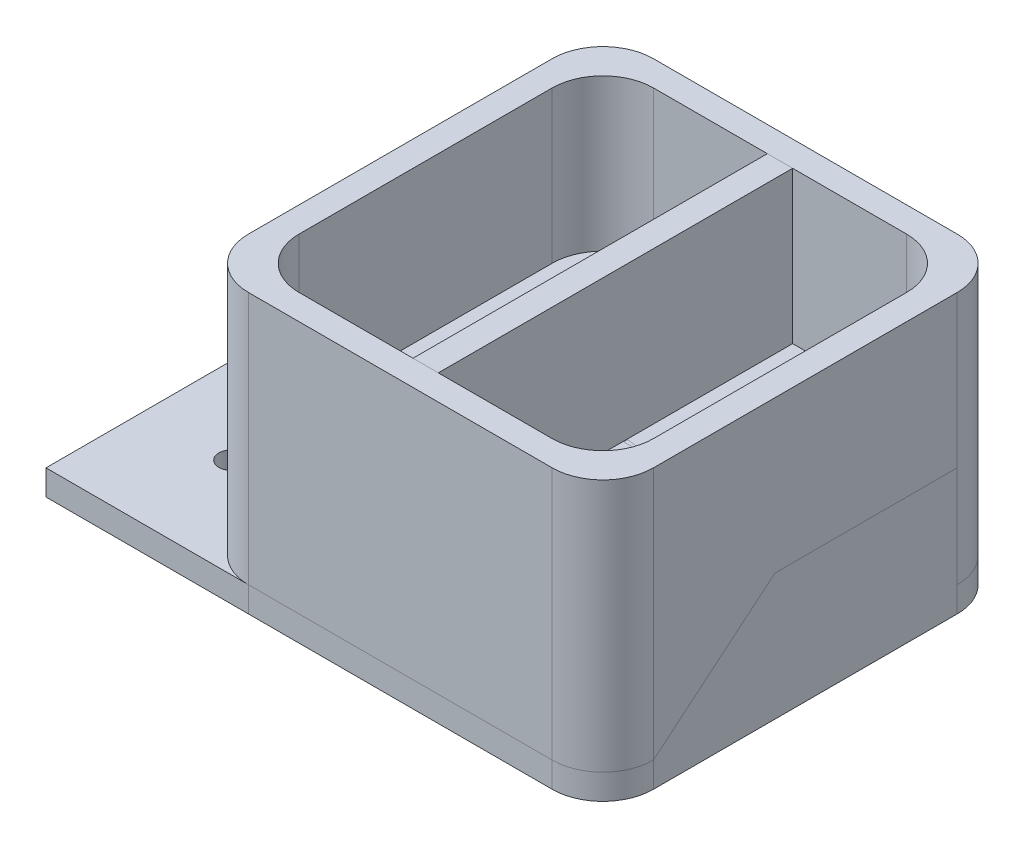
from build123d import *

# Parameters (mm, degrees)
BOSS_EXTRUDE1_DEPTH      = 50
BOSS_EXTRUDE3_DEPTH      = 50
SKETCH2_6_R              = 15
SKETCH2_6_R_2            = 8.5
BOSS_EXTRUDE4_DEPTH      = 20
BOSS_EXTRUDE4_2_DEPTH    = 20
BOSS_EXTRUDE5_DEPTH      = 20
BOSS_EXTRUDE5_DEPTH_BACK = 5
SKETCH2_7_R              = 2.5
SKETCH2_8_R              = 2.5
BOSS_EXTRUDE6_DEPTH      = 5


with BuildPart() as part:
    # Sketch2 → Boss-Extrude1 (new body)
    with BuildSketch(Plane(origin=(0, 0, 0), x_dir=(1, 0, 0), z_dir=(0, 1, 0))):
        with BuildLine():
            Line((65, 75), (5, 75))
            ThreePointArc((5, 75), (-2.071067812, 72.071067812), (-5, 65))
            Line((-5, 65), (-5, 5))
            ThreePointArc((-5, 5), (-2.071067812, -2.071067812), (5, -5))
            Line((5, -5), (65, -5))
            ThreePointArc((65, -5), (72.071067812, -2.071067812), (75, 5))
            Line((75, 5), (75, 65))
            ThreePointArc((75, 65), (72.071067812, 72.071067812), (65, 75))
        make_face()
        with BuildLine():
            Line((10, 70), (32.5, 70))
            Line((32.5, 70), (37.5, 70))
            Line((37.5, 70), (60, 70))
            ThreePointArc((60, 70), (67.071067812, 67.071067812), (70, 60))
            Line((70, 60), (70, 10))
            ThreePointArc((70, 10), (67.071067812, 2.928932188), (60, 0))
            Line((60, 0), (37.5, 0))
            Line((37.5, 0), (32.5, 0))
            Line((32.5, 0), (10, 0))
            ThreePointArc((10, 0), (2.928932188, 2.928932188), (0, 10))
            Line((0, 10), (0, 60))
            ThreePointArc((0, 60), (2.928932188, 67.071067812), (10, 70))
        make_face(mode=Mode.SUBTRACT)
    extrude(amount=BOSS_EXTRUDE1_DEPTH)


with BuildPart() as body_2:
    # Sketch2<5> → Boss-Extrude3 (new body)
    with BuildSketch(Plane(origin=(0, 0, 0), x_dir=(1, 0, 0), z_dir=(0, 1, 0))):
        Polygon((32.5, 70), (32.5, 35), (32.5, 0), (37.5, 0), (37.5, 35), (37.5, 70), align=None)
    extrude(amount=BOSS_EXTRUDE3_DEPTH)


with BuildPart() as body_3:
    # Sketch2<6> → Boss-Extrude4 (new body)
    with BuildSketch(Plane(origin=(0, 0, 0), x_dir=(1, 0, 0), z_dir=(0, 1, 0))):
        with Locations((17.5, 35)):
            Circle(SKETCH2_6_R)
        with Locations((17.5, 35)):
            Circle(SKETCH2_6_R_2, mode=Mode.SUBTRACT)
    extrude(amount=BOSS_EXTRUDE4_DEPTH)


with BuildPart() as body_4:
    # Sketch2<6> → Boss-Extrude4 2 (new body)
    with BuildSketch(Plane(origin=(0, 0, 0), x_dir=(1, 0, 0), z_dir=(0, 1, 0))):
        with Locations((52.5, 35)):
            Circle(SKETCH2_6_R)
        with Locations((52.5, 35)):
            Circle(SKETCH2_6_R_2, mode=Mode.SUBTRACT)
    extrude(amount=BOSS_EXTRUDE4_2_DEPTH)


with BuildPart() as body_5:
    # Sketch2<7> → Boss-Extrude5 (new, two sides: drawn at the far end of the back side and taken through both)
    with BuildSketch(Plane(origin=(0, 0, 0), x_dir=(1, 0, 0), z_dir=(0, 1, 0)).offset(-BOSS_EXTRUDE5_DEPTH_BACK)):
        with BuildLine():
            Line((65, 75), (5, 75))
            ThreePointArc((5, 75), (-2.071067812, 72.071067812), (-5, 65))
            Line((-5, 65), (-5, 5))
            ThreePointArc((-5, 5), (-2.071067812, -2.071067812), (5, -5))
            Line((5, -5), (65, -5))
            ThreePointArc((65, -5), (72.071067812, -2.071067812), (75, 5))
            Line((75, 5), (75, 65))
            ThreePointArc((75, 65), (72.071067812, 72.071067812), (65, 75))
        make_face()
        with Locations((17.5, 35)):
            Circle(SKETCH2_7_R, mode=Mode.SUBTRACT)
        with Locations((52.5, 35)):
            Circle(SKETCH2_7_R, mode=Mode.SUBTRACT)
    extrude(amount=BOSS_EXTRUDE5_DEPTH + BOSS_EXTRUDE5_DEPTH_BACK)


with BuildPart() as body_6:
    # Sketch2<8> → Boss-Extrude6 (new body)
    with BuildSketch(Plane(origin=(0, 0, 0), x_dir=(1, 0, 0), z_dir=(0, 1, 0))):
        with BuildLine():
            ThreePointArc((-5, 65), (-2.071067812, 72.071067812), (5, 75))
            Line((5, 75), (-35, 75))
            Line((-35, 75), (-35, -5))
            Line((-35, -5), (5, -5))
            ThreePointArc((5, -5), (-2.071067812, -2.071067812), (-5, 5))
            Line((-5, 5), (-5, 65))
        make_face()
        with Locations((-17.977583799, 14.644574594)):
            Circle(SKETCH2_8_R, mode=Mode.SUBTRACT)
        with Locations((-17.977583799, 55)):
            Circle(SKETCH2_8_R, mode=Mode.SUBTRACT)
    extrude(amount=-BOSS_EXTRUDE6_DEPTH)


solid = Compound([part.part, body_2.part, body_3.part, body_4.part, body_5.part, body_6.part])
